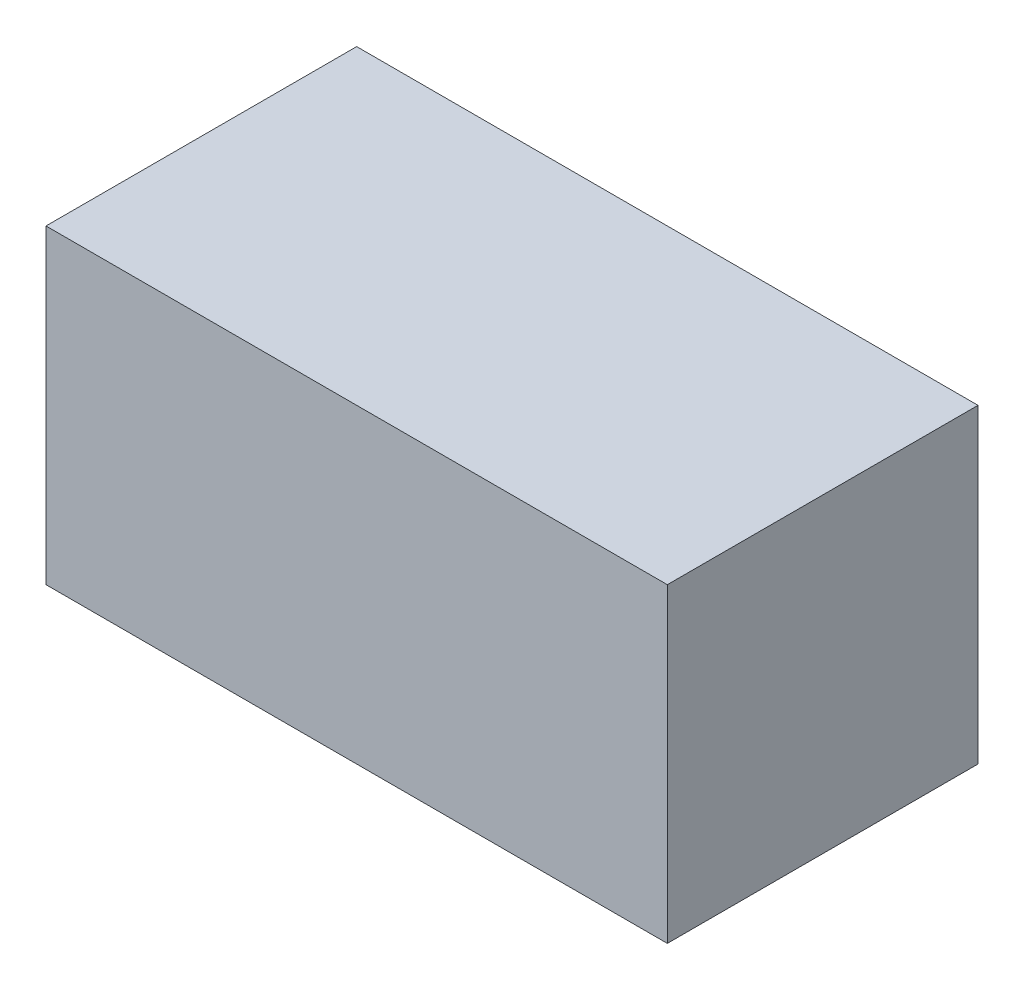
from build123d import *

# Parameters (mm, degrees)
SKETCH_1_W      = 100
SKETCH_1_H      = 50
EXTRUDE_1_DEPTH = 50


with BuildPart() as part:
    # 草图1 → 凸台-拉伸1 (new body)
    with BuildSketch(Plane(origin=(0, 0, 0), x_dir=(1, 0, 0), z_dir=(0, 1, 0))):
        with Locations((50, 25)):
            Rectangle(SKETCH_1_W, SKETCH_1_H)
    extrude(amount=EXTRUDE_1_DEPTH)


solid = part.part
